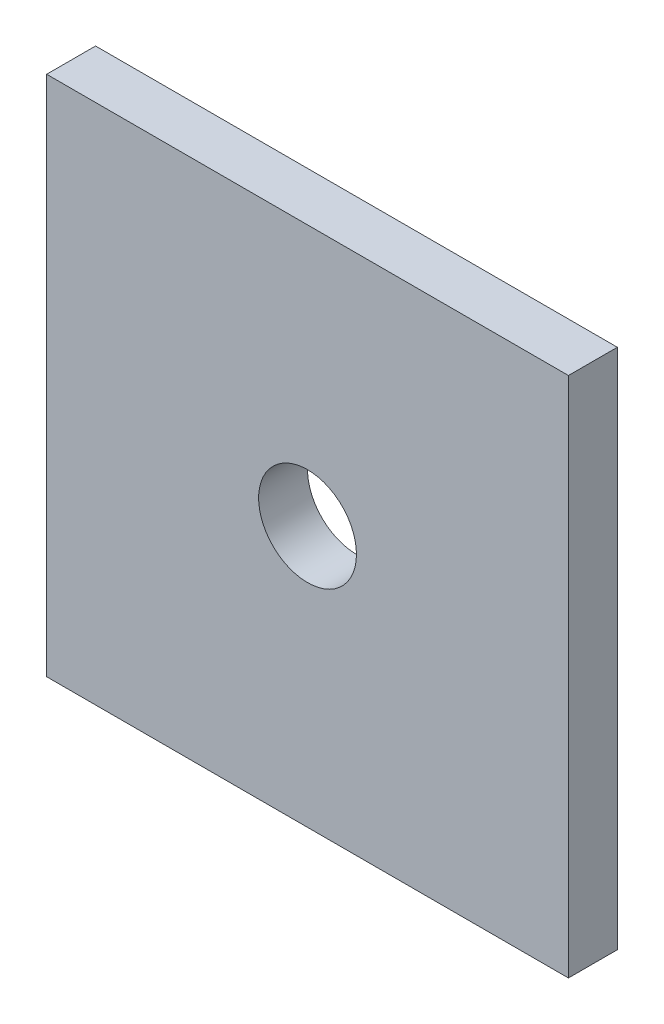
from build123d import *

# Parameters (mm, degrees)
ESQUISSE1_W             = 32
ESQUISSE1_H             = 32
BOSS_EXTRU_1_DEPTH      = 3
ESQUISSE2_R             = 3
ENL_V_MAT_EXTRU_1_DEPTH = 27.739395031


with BuildPart() as part:
    # Esquisse1 → Boss.-Extru.1 (new body)
    with BuildSketch(Plane.XY):
        with Locations((2.525211342, 3.047619048)):
            Rectangle(ESQUISSE1_W, ESQUISSE1_H)
    extrude(amount=BOSS_EXTRU_1_DEPTH)

    # Esquisse2 → Enlèv. mat.-Extru.1 (cut, through all)
    with BuildSketch(Plane.XY.offset(3)):
        with Locations((2.525211342, 3.047619048)):
            Circle(ESQUISSE2_R)
    extrude(amount=-ENL_V_MAT_EXTRU_1_DEPTH, mode=Mode.SUBTRACT)


solid = part.part
